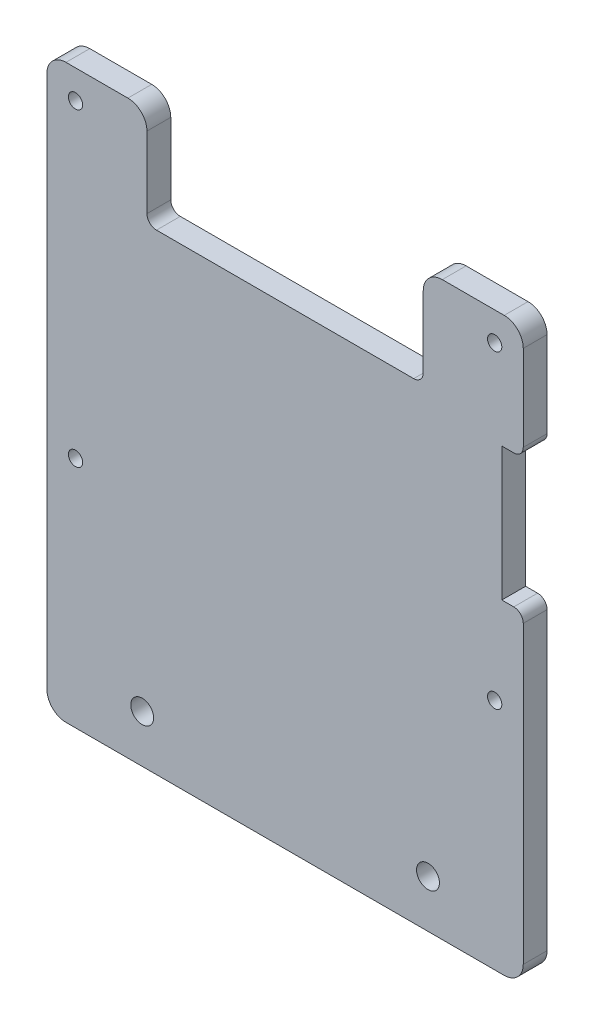
from build123d import *

# Parameters (mm, degrees)
SKETCH1_R           = 2.4
SKETCH1_R_2         = 1.5
BOSS_EXTRUDE1_DEPTH = 5
FILLET1_R           = 4
FILLET2_R           = 2


with BuildPart() as part:
    # Sketch1 → Boss-Extrude1 (new body)
    with BuildSketch(Plane.XY):
        Polygon((-50, -60), (50, -60), (50, 8), (45.5, 8), (45.5, 36), (50, 36), (50, 60), (29, 60), (29, 39), (-29, 39), (-29, 60), (-50, 60), align=None)
        with Locations((-30, -50)):
            Circle(SKETCH1_R, mode=Mode.SUBTRACT)
        with Locations((30, -50)):
            Circle(SKETCH1_R, mode=Mode.SUBTRACT)
        with Locations((-44, 54)):
            Circle(SKETCH1_R_2, mode=Mode.SUBTRACT)
        with Locations((44, 54)):
            Circle(SKETCH1_R_2, mode=Mode.SUBTRACT)
        with Locations((-44, -11)):
            Circle(SKETCH1_R_2, mode=Mode.SUBTRACT)
        with Locations((44, -11)):
            Circle(SKETCH1_R_2, mode=Mode.SUBTRACT)
    extrude(amount=BOSS_EXTRUDE1_DEPTH)

    # Fillet1
    fillet1_edges = [part.edges().sort_by_distance(p)[0] for p in [
        (50, -60, 2.5),
        (-50, -60, 2.5),
        (-50, 60, 2.5),
        (-29, 60, 2.5),
        (29, 60, 2.5),
        (50, 60, 2.5),
    ]]
    fillet(fillet1_edges, radius=FILLET1_R)

    # Fillet2
    fillet2_edges = [part.edges().sort_by_distance(p)[0] for p in [
        (50, 36, 2.5),
        (50, 8, 2.5),
        (-29, 39, 2.5),
        (29, 39, 2.5),
    ]]
    fillet(fillet2_edges, radius=FILLET2_R)


solid = part.part
